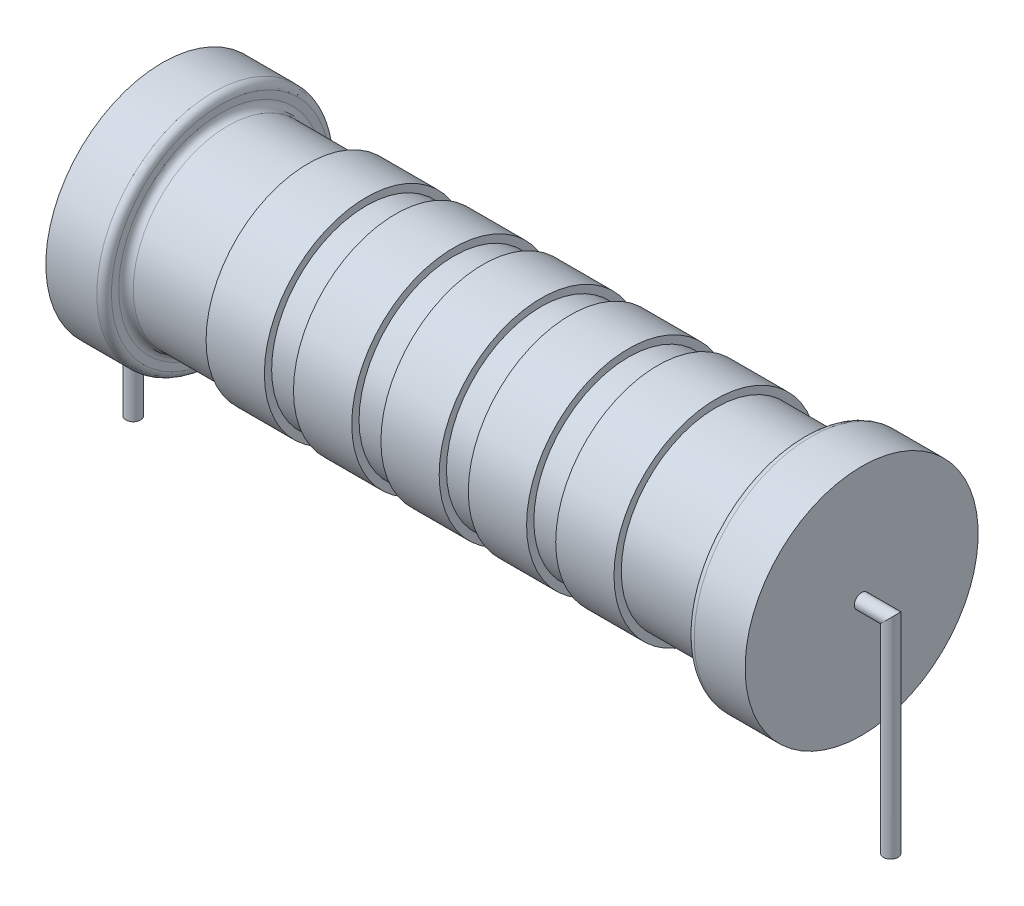
from build123d import *

# Parameters (mm, degrees)
FILLET_1_R        = 0.25
SKETCH_2_W        = 2
SKETCH_2_H        = 0.5
SWEEP_1_PROFILE_R = 0.25


with BuildPart() as part:
    # 草图1 → 旋转2 (revolve)
    with BuildSketch(Plane.XY, mode=Mode.PRIVATE) as revolve_2_sk:
        Polygon((-12, 0), (-12, 4), (-10, 4), (-10, 3.25), (10, 3.25), (10, 4), (12, 4), (12, 0), align=None)
    revolve(revolve_2_sk.sketch.rotate(Axis((-12, 0, 0), (1, 0, 0)), 180), axis=Axis((-12, 0, 0), (1, 0, 0)))

    # 圆角1
    fillet_1_edges = [part.edges().sort_by_distance(p)[0] for p in [
        (-10, 4, 0),
        (-10, 3.25, 0),
        (10, 3.25, 0),
        (10, 4, 0),
    ]]
    fillet(fillet_1_edges, radius=FILLET_1_R)

    # 草图2 → 旋转3 (revolve)
    with BuildSketch(Plane.XY, mode=Mode.PRIVATE) as revolve_3_sk:
        with Locations((3, 3.25)):
            Rectangle(SKETCH_2_W, SKETCH_2_H)
        with Locations((0, 3.25)):
            Rectangle(SKETCH_2_W, SKETCH_2_H)
        with Locations((6, 3.25)):
            Rectangle(SKETCH_2_W, SKETCH_2_H)
        with Locations((-3, 3.25)):
            Rectangle(SKETCH_2_W, SKETCH_2_H)
        with Locations((-6, 3.25)):
            Rectangle(SKETCH_2_W, SKETCH_2_H)
    revolve(revolve_3_sk.sketch.rotate(Axis((-1000, 0, 0), (1, 0, 0)), 90), axis=Axis((-1000, 0, 0), (1, 0, 0)))

    # 扫描1: sweep along a path in 草图3
    with BuildLine(Plane.XY) as sweep_1_path:
        Line((-12, 0), (-13, 0))
        Line((-13, 0), (-13, -7))
    # 扫描1 profile (on start of the path) → 扫描1 (sweep)
    with BuildSketch(Plane(origin=(-12, 0, 0), x_dir=(0, -1, 0), z_dir=(-1, 0, 0))):
        Circle(SWEEP_1_PROFILE_R)
    sweep_1 = sweep(path=sweep_1_path.line, transition=Transition.RIGHT)

    # 镜向1: 扫描1 across plane
    add(sweep_1.mirror(Plane(origin=(0, 0, 0), x_dir=(0, 0, 1), z_dir=(1, 0, 0))))


solid = part.part
